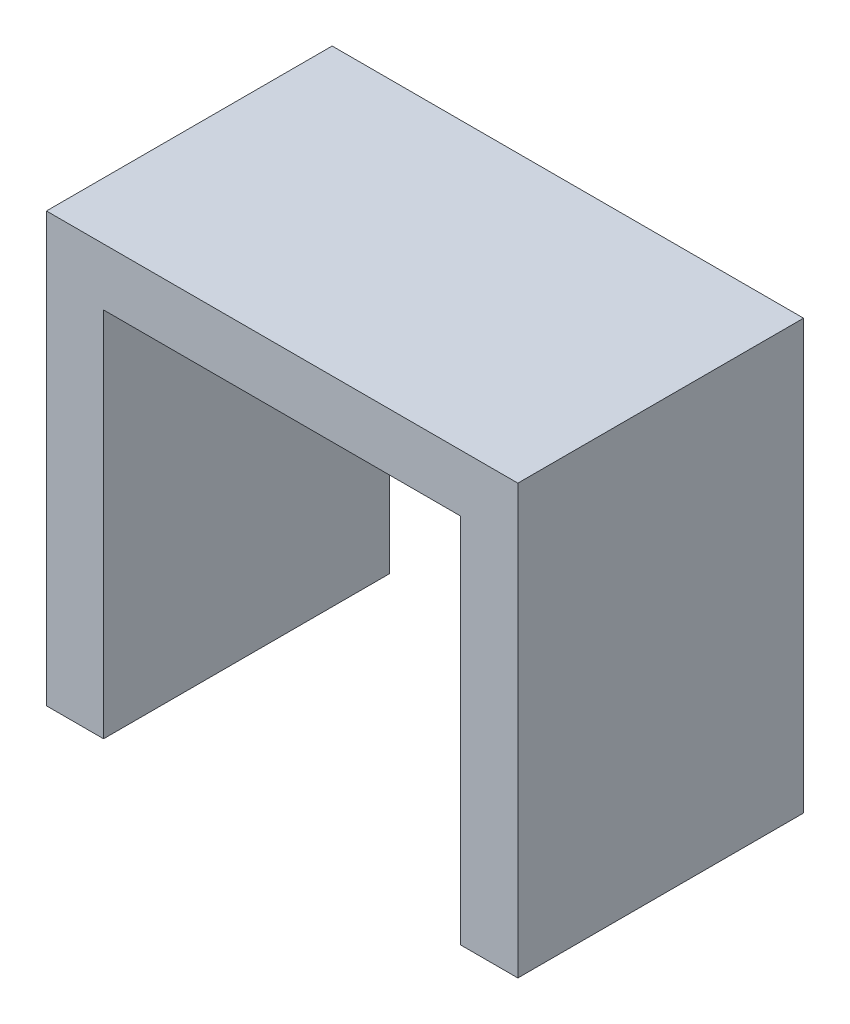
from build123d import *

# Parameters (mm, degrees)
BOSS_EXTRUDE1_DEPTH = 10


with BuildPart() as part:
    # Sketch1 → Boss-Extrude1 (new body)
    with BuildSketch(Plane.XY):
        Polygon((-12.598770082, 0), (-10.598770082, 0), (-10.598770082, 13), (1.901229918, 13), (1.901229918, 0), (3.901229918, 0), (3.901229918, 15), (-12.598770082, 15), align=None)
    extrude(amount=BOSS_EXTRUDE1_DEPTH)


solid = part.part
